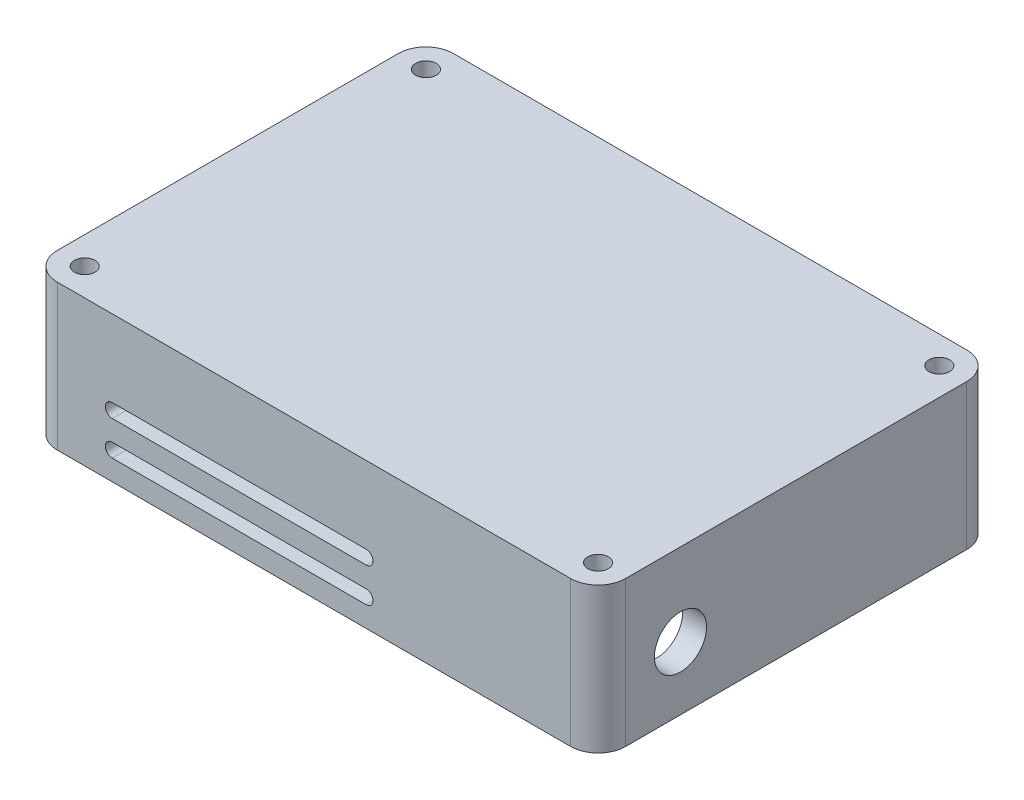
from build123d import *

# Parameters (mm, degrees)
SKETCH1_W           = 82.8
SKETCH1_H           = 57.7
BOSS_EXTRUDE1_DEPTH = 21.2
SKETCH2_R           = 1.5
CUT_EXTRUDE1_DEPTH  = 22
CUT_EXTRUDE2_DEPTH  = 20
FILLET3_R           = 4
BOSS_EXTRUDE3_START = 1
BOSS_EXTRUDE3_DEPTH = 1
CUT_EXTRUDE6_DEPTH  = 126.949440358
SKETCH8_R           = 3.8
CUT_EXTRUDE7_DEPTH  = 91.96532852


with BuildPart() as part:
    # Sketch1 → Boss-Extrude1 (new body)
    with BuildSketch(Plane(origin=(0, 0, 0), x_dir=(1, 0, 0), z_dir=(0, 1, 0))):
        with Locations((-68.529666271, 2.285365627)):
            Rectangle(SKETCH1_W, SKETCH1_H)
    extrude(amount=BOSS_EXTRUDE1_DEPTH)

    # Sketch2 → Cut-Extrude1 (cut)
    with BuildSketch(Plane.XZ):
        with Locations((-105.929666271, 22.574078856)):
            Circle(SKETCH2_R)
        with Locations((-31.129666271, 22.574078856)):
            Circle(SKETCH2_R)
        with Locations((-105.929666271, -27.14481011)):
            Circle(SKETCH2_R)
        with Locations((-31.129666271, -27.14481011)):
            Circle(SKETCH2_R)
    extrude(amount=-CUT_EXTRUDE1_DEPTH, mode=Mode.SUBTRACT)

    # Sketch3 → Cut-Extrude2 (cut)
    with BuildSketch(Plane.XZ):
        with BuildLine():
            Line((-101.969305307, 23.064634373), (-35.090027235, 23.064634373))
            ThreePointArc((-35.090027235, 23.064634373), (-33.948648913, 19.745651731), (-30.629666271, 18.604273409))
            Line((-30.629666271, 18.604273409), (-30.629666271, -23.175004663))
            ThreePointArc((-30.629666271, -23.175004663), (-33.948648913, -24.316382985), (-35.090027235, -27.635365627))
            Line((-35.090027235, -27.635365627), (-101.969305307, -27.635365627))
            ThreePointArc((-101.969305307, -27.635365627), (-103.110683629, -24.316382985), (-106.429666271, -23.175004663))
            Line((-106.429666271, -23.175004663), (-106.429666271, 18.607164142))
            ThreePointArc((-106.429666271, 18.607164142), (-103.111962249, 19.747670443), (-101.969305307, 23.064634373))
        make_face()
    extrude(amount=-CUT_EXTRUDE2_DEPTH, mode=Mode.SUBTRACT)

    # Fillet3
    fillet3_edges = [part.edges().sort_by_distance(p)[0] for p in [
        (-27.129666271, 10.6, 26.564634373),
        (-109.929666271, 10.6, 26.564634373),
        (-109.929666271, 10.6, -31.135365627),
        (-27.129666271, 10.6, -31.135365627),
    ]]
    fillet(fillet3_edges, radius=FILLET3_R)

    # Sketch3<8> → Boss-Extrude3 (add)
    with BuildSketch(Plane.XZ.offset(BOSS_EXTRUDE3_START)):
        with BuildLine():
            Line((-103.334287863, 24.064634373), (-33.723727934, 24.064634373))
            ThreePointArc((-33.723727934, 24.064634373), (-33.241542132, 20.452758513), (-29.629666271, 19.97057271))
            Line((-29.629666271, 19.97057271), (-29.629666271, -24.541303964))
            ThreePointArc((-29.629666271, -24.541303964), (-33.241542132, -25.023489766), (-33.723727934, -28.635365627))
            Line((-33.723727934, -28.635365627), (-103.335604608, -28.635365627))
            ThreePointArc((-103.335604608, -28.635365627), (-103.817790411, -25.023489766), (-107.429666271, -24.541303964))
            Line((-107.429666271, -24.541303964), (-107.429666271, 19.973301106))
            ThreePointArc((-107.429666271, 19.973301106), (-103.819200468, 20.454646008), (-103.334287863, 24.064634373))
        make_face()
        with BuildLine():
            Line((-101.969305307, 23.064634373), (-35.090027235, 23.064634373))
            ThreePointArc((-35.090027235, 23.064634373), (-33.948648913, 19.745651731), (-30.629666271, 18.604273409))
            Line((-30.629666271, 18.604273409), (-30.629666271, -23.175004663))
            ThreePointArc((-30.629666271, -23.175004663), (-33.948648913, -24.316382985), (-35.090027235, -27.635365627))
            Line((-35.090027235, -27.635365627), (-101.969305307, -27.635365627))
            ThreePointArc((-101.969305307, -27.635365627), (-103.110683629, -24.316382985), (-106.429666271, -23.175004663))
            Line((-106.429666271, -23.175004663), (-106.429666271, 18.607164142))
            ThreePointArc((-106.429666271, 18.607164142), (-103.111962249, 19.747670443), (-101.969305307, 23.064634373))
        make_face(mode=Mode.SUBTRACT)
    extrude(amount=-BOSS_EXTRUDE3_DEPTH)

    # Sketch7 → Cut-Extrude6 (cut, through all)
    with BuildSketch(Plane(origin=(0, 0, -31.135365627), x_dir=(-1, 0, 0), z_dir=(0, 0, -1))):
        with BuildLine():
            Line((60.929666271, 3), (97.929666271, 3))
            ThreePointArc((97.929666271, 3), (98.929666271, 4), (97.929666271, 5))
            Line((97.929666271, 5), (60.929666271, 5))
            ThreePointArc((60.929666271, 5), (59.929666271, 4), (60.929666271, 3))
        make_face()
        with BuildLine():
            Line((60.929666271, 8), (97.929666271, 8))
            ThreePointArc((97.929666271, 8), (98.929666271, 9), (97.929666271, 10))
            Line((97.929666271, 10), (60.929666271, 10))
            ThreePointArc((60.929666271, 10), (59.929666271, 9), (60.929666271, 8))
        make_face()
    extrude(amount=-CUT_EXTRUDE6_DEPTH, mode=Mode.SUBTRACT)

    # Sketch8 → Cut-Extrude7 (cut, through all)
    with BuildSketch(Plane.ZY.offset(109.929666271)):
        with Locations((14.564634373, 9.2)):
            Circle(SKETCH8_R)
    extrude(amount=-CUT_EXTRUDE7_DEPTH, mode=Mode.SUBTRACT)


solid = part.part
